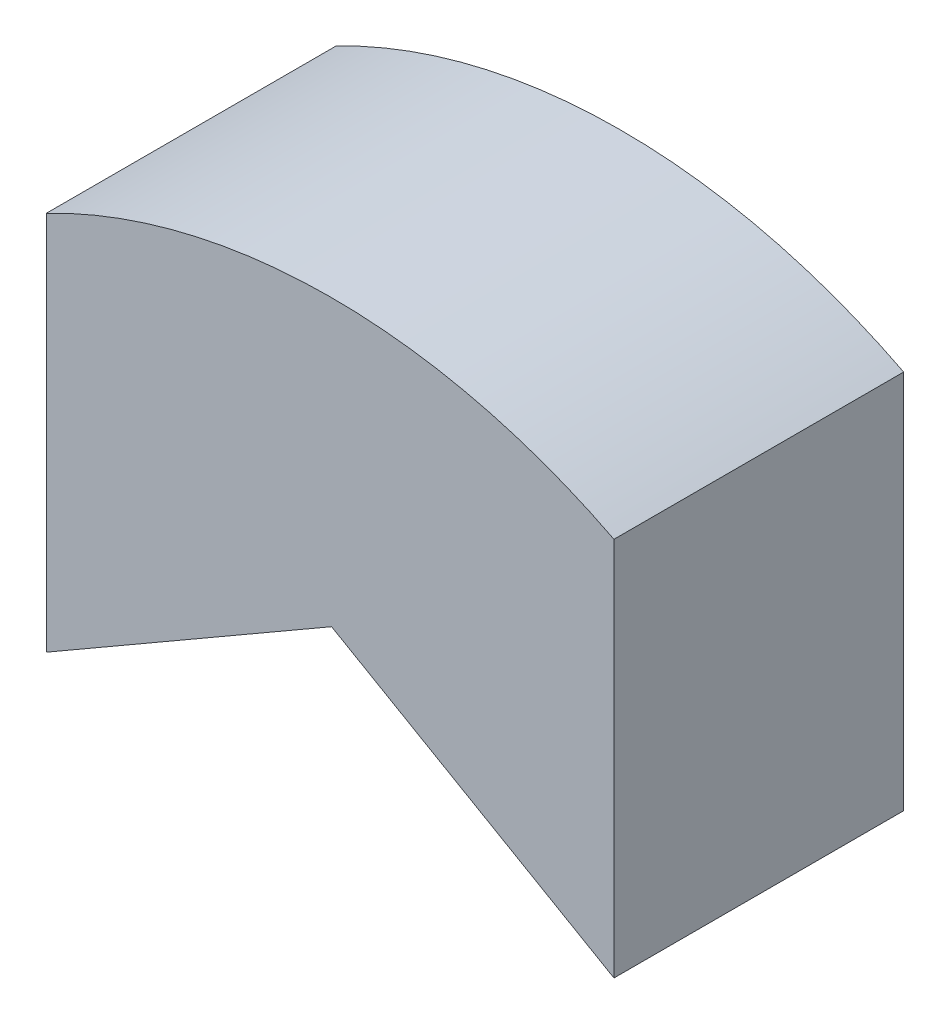
from build123d import *

# Parameters (mm, degrees)
BOSS_EXTRUDE1_DEPTH = 6.5


with BuildPart() as part:
    # Sketch1 → Boss-Extrude1 (new body)
    with BuildSketch(Plane.XY):
        with BuildLine():
            Line((6.335498205, 3.847751906), (0, 7.505553499))
            Line((0, 7.505553499), (-6.4, 3.810511777))
            Line((-6.4, 3.810511777), (-6.4, 12.338962679))
            ThreePointArc((-6.4, 12.338962679), (-0.036282053, 13.899952648), (6.335498205, 12.37220524))
            Line((6.335498205, 12.37220524), (6.335498205, 3.847751906))
        make_face()
    extrude(amount=BOSS_EXTRUDE1_DEPTH)


solid = part.part
